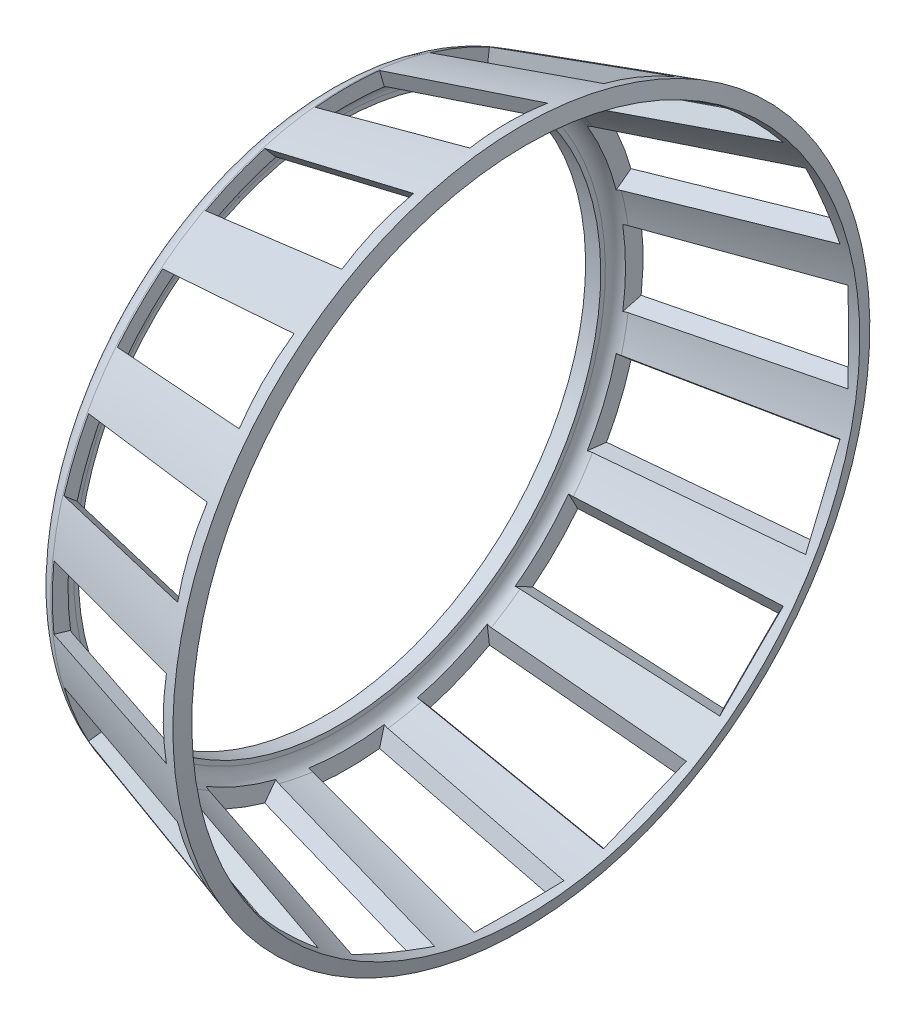
from build123d import *

# Parameters (mm, degrees)
ENL_V_MAT_EXTRU_1_DEPTH      = 2
ENL_V_MAT_EXTRU_1_TAPER      = -20
R_P_TITION_CIRCULAIRE1_COUNT = 16


with BuildPart() as part:
    # Esquisse1 → Base-Révolution (revolve)
    with BuildSketch(Plane.XY):
        with BuildLine():
            Line((-14.780440552, 19.466558031), (-3.189952461, 23.010125854))
            Line((-3.189952461, 23.010125854), (-2.897580757, 22.053821098))
            Line((-2.897580757, 22.053821098), (-14.488068847, 18.510253275))
            ThreePointArc((-14.488068847, 18.510253275), (-14.999554003, 18.148771306), (-15.195697142, 17.55394852))
            Line((-15.195697142, 17.55394852), (-15.195697142, 17.248217838))
            Line((-15.195697142, 17.248217838), (-16.195697142, 17.248217838))
            Line((-16.195697142, 17.248217838), (-16.195697142, 17.55394852))
            ThreePointArc((-16.195697142, 17.55394852), (-15.803410864, 18.743594093), (-14.780440552, 19.466558031))
        make_face()
    revolve(axis=Axis((-3.385649604, 0, 0), (-1, 0, 0)))

    # Esquisse4 → Enlèv. mat.-Extru.1 (cut)
    with BuildSketch(Plane(origin=(-8.985196507, 21.238341943, 0), x_dir=(0, 0, -1), z_dir=(-0.292371704722731, 0.9563047559630373, 0))):
        Polygon((2.073639609, 5.935595689), (-2.073639609, 5.935595689), (-2.512210689, -5.09802861), (2.512210689, -5.09802861), align=None)
    enl_v_mat_extru_1 = extrude(amount=-ENL_V_MAT_EXTRU_1_DEPTH, taper=ENL_V_MAT_EXTRU_1_TAPER, mode=Mode.SUBTRACT)

    # Répétition circulaire1: Enlèv. mat.-Extru.1 ×16 about axis
    r_p_tition_circulaire1_axis = Axis((-3.385649604, 0, 0), (-1, 0, 0))
    for i in range(1, R_P_TITION_CIRCULAIRE1_COUNT):
        add(enl_v_mat_extru_1.rotate(r_p_tition_circulaire1_axis, i * 360 / R_P_TITION_CIRCULAIRE1_COUNT), mode=Mode.SUBTRACT)


solid = part.part
